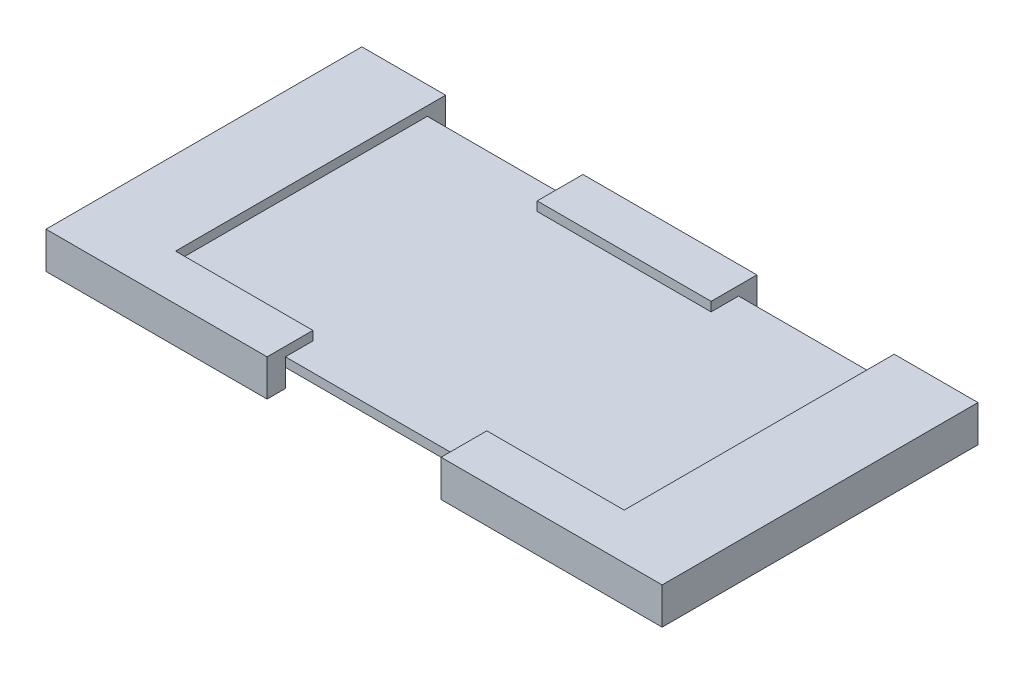
from build123d import *

# Parameters (mm, degrees)
SKETCH_1_W          = 67.3
SKETCH_1_H          = 34.5
EXTRUDE_1_DEPTH     = 4
SKETCH_2_W          = 15
SKETCH_2_H          = 29.5
CUT_EXTRUDE_1_DEPTH = 1
SKETCH_3_W          = 63.3
SKETCH_3_H          = 30.5
CUT_EXTRUDE_2_DEPTH = 2
SKETCH_4_W          = 15
SKETCH_4_H          = 3
CUT_EXTRUDE_3_DEPTH = 2
SKETCH_6_W          = 19
SKETCH_6_H          = 29.5
CUT_EXTRUDE_5_DEPTH = 1
SKETCH_5_W          = 19
SKETCH_5_H          = 3
CUT_EXTRUDE_4_DEPTH = 2


with BuildPart() as part:
    # Эскиз1 → Бобышка-Вытянуть1 (new body)
    with BuildSketch(Plane(origin=(0, 0, 0), x_dir=(1, 0, 0), z_dir=(0, 1, 0))):
        Rectangle(SKETCH_1_W, SKETCH_1_H)
    extrude(amount=EXTRUDE_1_DEPTH)

    # Эскиз2 → Вырез-Вытянуть1 (cut)
    with BuildSketch(Plane(origin=(0, 4, 0), x_dir=(1, 0, 0), z_dir=(0, 1, 0))):
        with Locations((-17, 2.5)):
            Rectangle(SKETCH_2_W, SKETCH_2_H)
        with Locations((17, 2.5)):
            Rectangle(SKETCH_2_W, SKETCH_2_H)
    extrude(amount=-CUT_EXTRUDE_1_DEPTH, mode=Mode.SUBTRACT)

    # Эскиз3 → Вырез-Вытянуть2 (cut)
    with BuildSketch(Plane(origin=(0, 0, 0), x_dir=(-1, 0, 0), z_dir=(0, -1, 0))):
        Rectangle(SKETCH_3_W, SKETCH_3_H)
    extrude(amount=-CUT_EXTRUDE_2_DEPTH, mode=Mode.SUBTRACT)

    # Эскиз4 → Вырез-Вытянуть3 (cut)
    with BuildSketch(Plane(origin=(0, 0, -17.25), x_dir=(-1, 0, 0), z_dir=(0, 0, -1))):
        with Locations((-17, 1.5)):
            Rectangle(SKETCH_4_W, SKETCH_4_H)
        with Locations((17, 1.5)):
            Rectangle(SKETCH_4_W, SKETCH_4_H)
    extrude(amount=-CUT_EXTRUDE_3_DEPTH, mode=Mode.SUBTRACT)

    # Эскиз6 → Вырез-Вытянуть5 (cut)
    with BuildSketch(Plane(origin=(0, 4, 0), x_dir=(1, 0, 0), z_dir=(0, 1, 0))):
        with Locations((0, -2.5)):
            Rectangle(SKETCH_6_W, SKETCH_6_H)
    extrude(amount=-CUT_EXTRUDE_5_DEPTH, mode=Mode.SUBTRACT)

    # Эскиз5 → Вырез-Вытянуть4 (cut)
    with BuildSketch(Plane.XY.offset(17.25)):
        with Locations((0, 1.5)):
            Rectangle(SKETCH_5_W, SKETCH_5_H)
    extrude(amount=-CUT_EXTRUDE_4_DEPTH, mode=Mode.SUBTRACT)


solid = part.part
